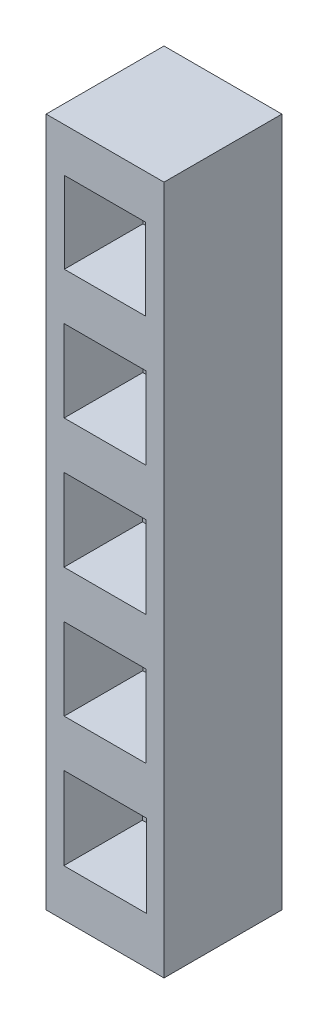
from build123d import *

# Parameters (mm, degrees)
SKETCH_1_W          = 15
SKETCH_1_H          = 100
EXTRUDE_1_DEPTH     = 15
SKETCH_3_W          = 10.35
SKETCH_3_H          = 10.35
SKETCH_3_W_2        = 10.4
SKETCH_3_H_2        = 10.4
SKETCH_3_W_3        = 10.45
SKETCH_3_H_3        = 10.45
SKETCH_3_W_4        = 10.5
SKETCH_3_H_4        = 10.5
CUT_EXTRUDE_1_DEPTH = 10
SKETCH_4_W          = 15
SKETCH_4_H          = 12.316827503
CUT_EXTRUDE_2_DEPTH = 53.737557774


with BuildPart() as part:
    # 草图1 → 凸台-拉伸1 (new body)
    with BuildSketch(Plane.XY):
        Rectangle(SKETCH_1_W, SKETCH_1_H)
    extrude(amount=EXTRUDE_1_DEPTH)

    # 草图3 → 切除-拉伸1 (cut)
    with BuildSketch(Plane.XY.offset(15)):
        with Locations((0, 26.925)):
            Rectangle(SKETCH_3_W, SKETCH_3_H)
        with Locations((0, 10.55)):
            Rectangle(SKETCH_3_W_2, SKETCH_3_H_2)
        with Locations((0, -5.875)):
            Rectangle(SKETCH_3_W_3, SKETCH_3_H_3)
        with Locations((0, -22.3)):
            Rectangle(SKETCH_3_W_2, SKETCH_3_H_2)
        with Locations((0, -38.75)):
            Rectangle(SKETCH_3_W_4, SKETCH_3_H_4)
    extrude(amount=-CUT_EXTRUDE_1_DEPTH, mode=Mode.SUBTRACT)

    # 草图4 → 切除-拉伸2 (cut, through all)
    with BuildSketch(Plane.XY.offset(15)):
        with Locations((0, 43.841586249)):
            Rectangle(SKETCH_4_W, SKETCH_4_H)
    extrude(amount=-CUT_EXTRUDE_2_DEPTH, mode=Mode.SUBTRACT)


solid = part.part
